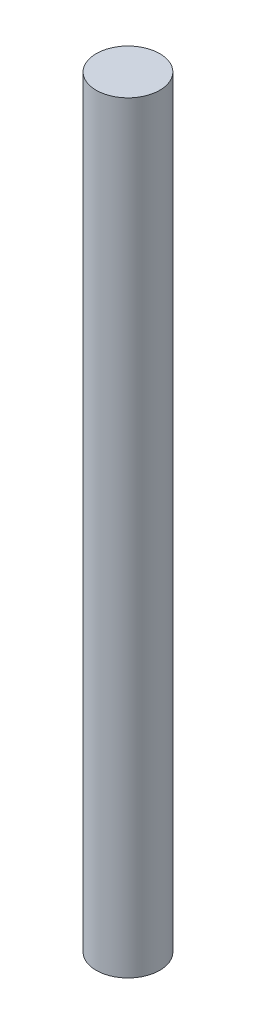
from build123d import *

# Parameters (mm, degrees)
SKETCH1_R           = 5
BOSS_EXTRUDE1_DEPTH = 120


with BuildPart() as part:
    # Sketch1 → Boss-Extrude1 (new body)
    with BuildSketch(Plane(origin=(0, 0, 0), x_dir=(1, 0, 0), z_dir=(0, 1, 0))):
        with Locations(Location((0, 0, 0), (0, 0, 270))):
            Circle(SKETCH1_R)
    extrude(amount=BOSS_EXTRUDE1_DEPTH)


solid = part.part
